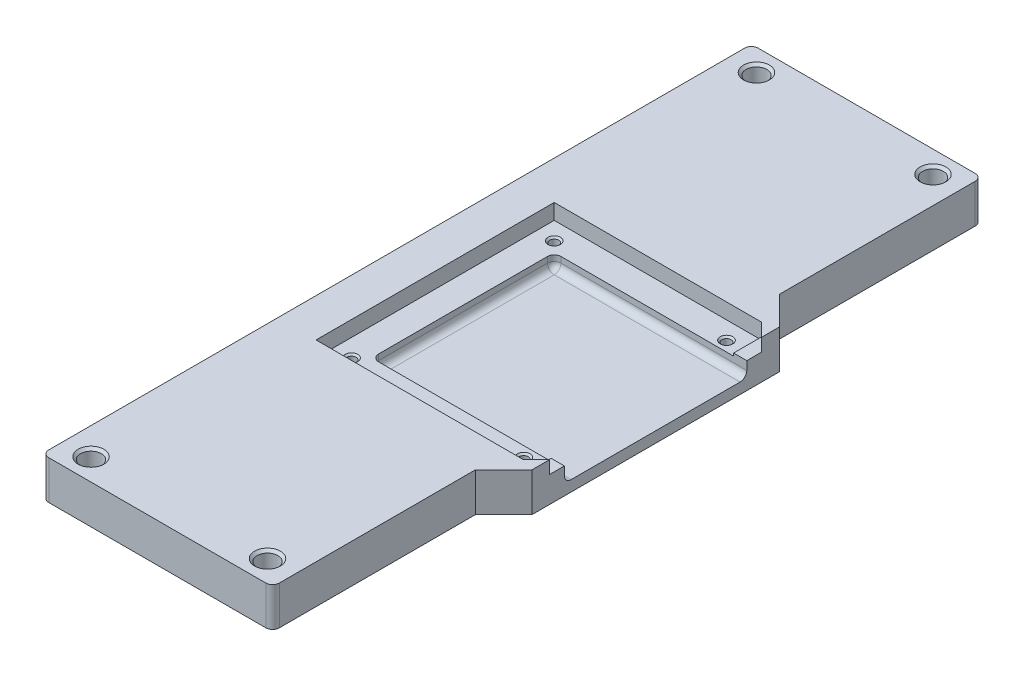
from build123d import *

# Parameters (mm, degrees)
BOSS_EXTRUDE1_DEPTH     = 11.5
SKETCH4_R               = 3.075
CUT_EXTRUDE1_DEPTH      = 6
BOSS_EXTRUDE3_DEPTH     = 11.5
CUT_EXTRUDE6_DEPTH      = 4.6
CUT_EXTRUDE3_DEPTH      = 114.485065097
CUT_EXTRUDE3_DEPTH_BACK = 3.7
SKETCH24_W              = 57
SKETCH24_H              = 54
SKETCH25_R              = 1.35
CUT_EXTRUDE4_DEPTH      = 5
CHAMFER4_SIZE           = 0.5
FILLET1_R               = 2
BOSS_EXTRUDE2_DEPTH     = 0.8
CHAMFER5_SIZE           = 0.75


with BuildPart() as part:
    # Sketch1 → Boss-Extrude1 (new body)
    with BuildSketch(Plane(origin=(0, 0, 0), x_dir=(1, 0, 0), z_dir=(0, 1, 0))):
        with BuildLine():
            Line((-34.125, 90), (-34.125, -90))
            Line((-34.125, -90), (-34.125, -103))
            ThreePointArc((-34.125, -103), (-33.539213562, -104.414213562), (-32.125, -105))
            Line((-32.125, -105), (32.125, -105))
            ThreePointArc((32.125, -105), (33.539213562, -104.414213562), (34.125, -103))
            Line((34.125, -103), (34.125, -90))
            Line((34.125, -90), (34.125, 90))
            Line((34.125, 90), (34.125, 103))
            ThreePointArc((34.125, 103), (33.539213562, 104.414213562), (32.125, 105))
            Line((32.125, 105), (-32.125, 105))
            ThreePointArc((-32.125, 105), (-33.539213562, 104.414213562), (-34.125, 103))
            Line((-34.125, 103), (-34.125, 90))
        make_face()
    extrude(amount=BOSS_EXTRUDE1_DEPTH)

    # Sketch4 → Cut-Extrude1 (cut)
    with BuildSketch(Plane(origin=(0, 11.5, 0), x_dir=(1, 0, 0), z_dir=(0, 1, 0))):
        with Locations(Location((-26.125, -98.5, 0), (0, 0, 270))):
            Circle(SKETCH4_R)
        with Locations(Location((26.125, -98.5, 0), (0, 0, 270))):
            Circle(SKETCH4_R)
        with Locations(Location((26.125, 98.5, 0), (0, 0, 270))):
            Circle(SKETCH4_R)
        with Locations(Location((-26.125, 98.5, 0), (0, 0, 270))):
            Circle(SKETCH4_R)
    extrude(amount=-CUT_EXTRUDE1_DEPTH, mode=Mode.SUBTRACT)

    # Sketch27 → Boss-Extrude3 (add)
    with BuildSketch(Plane(origin=(0, 11.5, 0), x_dir=(1, 0, 0), z_dir=(0, 1, 0))):
        Polygon((34.125, 45), (42.5, 36.625), (42.5, -36.625), (34.125, -45), align=None)
    extrude(amount=-BOSS_EXTRUDE3_DEPTH)

    # Sketch21 → Cut-Extrude6 (cut)
    with BuildSketch(Plane(origin=(0, 11.5, 0), x_dir=(1, 0, 0), z_dir=(0, 1, 0))):
        Polygon((42.5, 31.353553391), (42.5, -31.353553391), (38.603553391, -35.25), (-22.75, -35.25), (-22.75, 35.25), (38.603553391, 35.25), align=None)
    extrude(amount=-CUT_EXTRUDE6_DEPTH, mode=Mode.SUBTRACT)

    # Sketch24 → Cut-Extrude3 (cut, two sides: drawn at the far end of the back side and taken through both)
    with BuildSketch(Plane(origin=(0, 6.9, 0), x_dir=(1, 0, 0), z_dir=(0, 1, 0)).offset(-CUT_EXTRUDE3_DEPTH_BACK)):
        with Locations((14, 0)):
            Rectangle(SKETCH24_W, SKETCH24_H)
    extrude(amount=CUT_EXTRUDE3_DEPTH + CUT_EXTRUDE3_DEPTH_BACK, mode=Mode.SUBTRACT)

    # Sketch25 → Cut-Extrude4 (cut)
    with BuildSketch(Plane(origin=(0, 6.9, 0), x_dir=(1, 0, 0), z_dir=(0, 1, 0))):
        with Locations(Location((33.5, 30, 0), (0, 0, 270))):
            Circle(SKETCH25_R)
        with Locations(Location((-17.5, 30, 0), (0, 0, 270))):
            Circle(SKETCH25_R)
        with Locations(Location((33.5, -30, 0), (0, 0, 270))):
            Circle(SKETCH25_R)
        with Locations(Location((-17.5, -30, 0), (0, 0, 270))):
            Circle(SKETCH25_R)
    extrude(amount=-CUT_EXTRUDE4_DEPTH, mode=Mode.SUBTRACT)

    # Chamfer4
    chamfer4_edges = [part.edges().sort_by_distance(p)[0] for p in [
        (-17.5, 6.9, -31.35),
        (33.5, 6.9, 28.65),
        (-17.5, 6.9, 28.65),
        (33.5, 6.9, -31.35),
    ]]
    chamfer(chamfer4_edges, length=CHAMFER4_SIZE)

    # Fillet1
    fillet1_edges = [part.edges().sort_by_distance(p)[0] for p in [
        (14, 3.2, -27),
        (-14.5, 5.05, -27),
        (-14.5, 3.2, 0),
        (-14.5, 5.05, 27),
        (14, 3.2, 27),
    ]]
    fillet(fillet1_edges, radius=FILLET1_R)

    # Sketch26 → Boss-Extrude2 (add)
    with BuildSketch(Plane(origin=(0, 6.9, 0), x_dir=(1, 0, 0), z_dir=(0, 1, 0))):
        Polygon((38.603553391, 35.25), (38.603553391, 27), (42.5, 27), (42.5, 31.353553391), align=None)
        Polygon((42.5, -31.353553391), (38.603553391, -35.25), (38.603553391, -27), (42.5, -27), align=None)
    extrude(amount=BOSS_EXTRUDE2_DEPTH)

    # Chamfer5
    chamfer5_edges = [part.edges().sort_by_distance(p)[0] for p in [
        (-26.125, 11.5, -101.575),
        (26.125, 11.5, -101.575),
        (26.125, 11.5, 95.425),
        (-26.125, 11.5, 95.425),
    ]]
    chamfer(chamfer5_edges, length=CHAMFER5_SIZE)


solid = part.part
